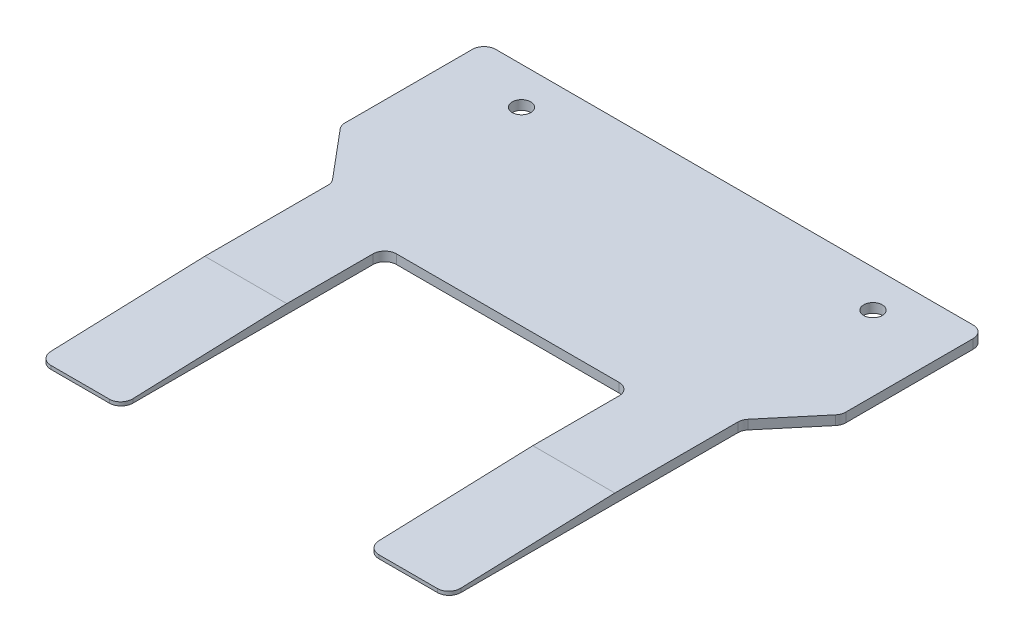
from build123d import *

# Parameters (mm, degrees)
SKETCH1_R           = 1.5875
BOSS_EXTRUDE1_DEPTH = 1.5875
CUT_EXTRUDE2_DEPTH  = 116.621246561


with BuildPart() as part:
    # Sketch1 → Boss-Extrude1 (new body)
    with BuildSketch(Plane(origin=(0, 0, 0), x_dir=(1, 0, 0), z_dir=(0, 1, 0))):
        with BuildLine():
            Line((-35, -34.427940469), (-35, -81.7))
            ThreePointArc((-35, -81.7), (-34.414213562, -83.114213562), (-33, -83.7))
            Line((-33, -83.7), (-23, -83.7))
            ThreePointArc((-23, -83.7), (-21.585786438, -83.114213562), (-21, -81.7))
            Line((-21, -81.7), (-21, -40.7))
            ThreePointArc((-21, -40.7), (-20.414213562, -39.285786438), (-19, -38.7))
            Line((-19, -38.7), (19, -38.7))
            ThreePointArc((19, -38.7), (20.414213562, -39.285786438), (21, -40.7))
            Line((21, -40.7), (21, -81.7))
            ThreePointArc((21, -81.7), (21.585786438, -83.114213562), (23, -83.7))
            Line((23, -83.7), (33, -83.7))
            ThreePointArc((33, -83.7), (34.414213562, -83.114213562), (35, -81.7))
            Line((35, -81.7), (35, -34.427940469))
            ThreePointArc((35, -34.427940469), (35.120614758, -33.743900182), (35.467911114, -33.142365249))
            Line((35.467911114, -33.142365249), (42.282088886, -25.021544408))
            ThreePointArc((42.282088886, -25.021544408), (42.629385242, -24.420009476), (42.75, -23.735969189))
            Line((42.75, -23.735969189), (42.75, -2))
            ThreePointArc((42.75, -2), (42.164213562, -0.585786438), (40.75, 0))
            Line((40.75, 0), (-40.75, 0))
            ThreePointArc((-40.75, 0), (-42.164213562, -0.585786438), (-42.75, -2))
            Line((-42.75, -2), (-42.75, -23.735969189))
            ThreePointArc((-42.75, -23.735969189), (-42.629385242, -24.420009476), (-42.282088886, -25.021544408))
            Line((-42.282088886, -25.021544408), (-35.467911114, -33.142365249))
            ThreePointArc((-35.467911114, -33.142365249), (-35.120614758, -33.743900182), (-35, -34.427940469))
        make_face()
        with Locations(Location((-30, -6.35, 0), (0, 0, 270))):
            Circle(SKETCH1_R, mode=Mode.SUBTRACT)
        with Locations(Location((30, -6.35, 0), (0, 0, 270))):
            Circle(SKETCH1_R, mode=Mode.SUBTRACT)
    extrude(amount=BOSS_EXTRUDE1_DEPTH)

    # Sketch3 → Cut-Extrude2 (cut, through all)
    with BuildSketch(Plane(origin=(37, 0, 0), x_dir=(0, 0, -1), z_dir=(1, 0, 0))):
        Polygon((-81.7, 1.5875), (-55.421699883, 1.5875), (-83.7, 0.6), (-83.7, 1.5875), align=None)
    extrude(amount=-CUT_EXTRUDE2_DEPTH, mode=Mode.SUBTRACT)


solid = part.part
